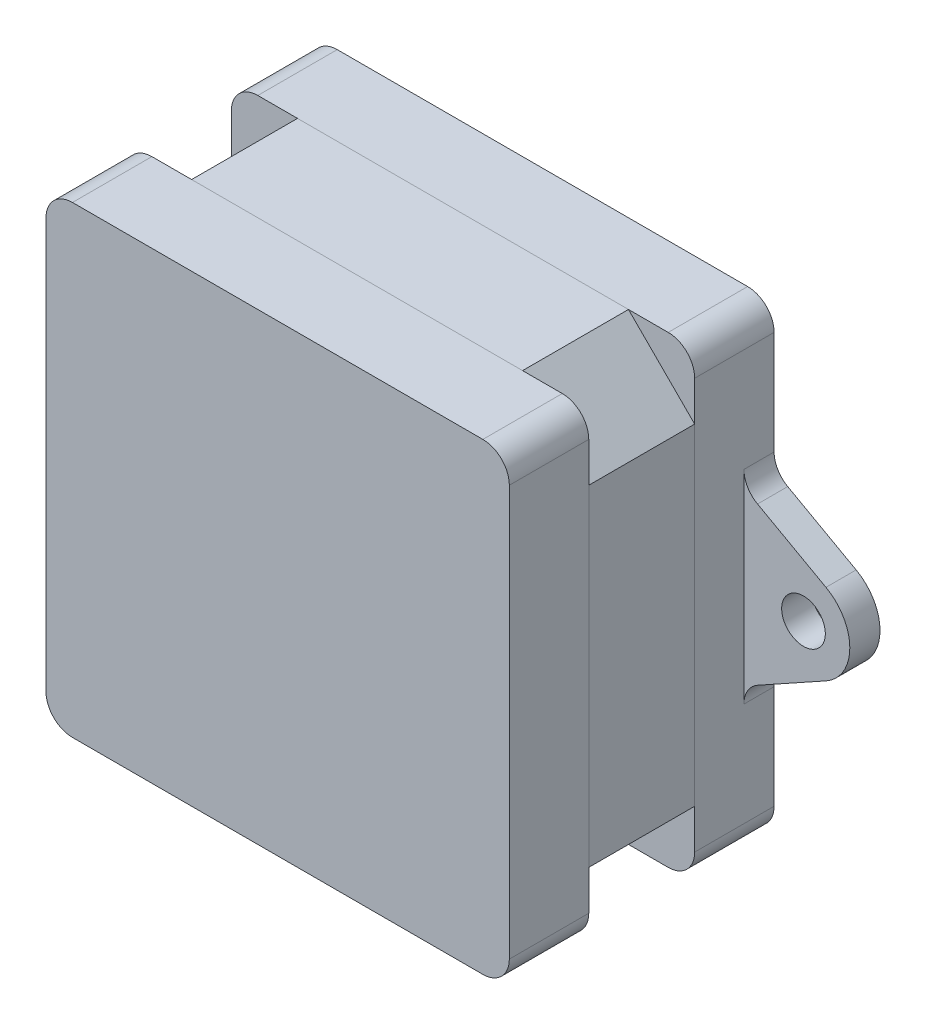
from build123d import *

# Parameters (mm, degrees)
SKETCH1_W                  = 35
SKETCH1_H                  = 35
BOSS_EXTRUDE1_DEPTH        = 6
BOSS_EXTRUDE2_DEPTH        = 8
SKETCH3_W                  = 35
SKETCH3_H                  = 35
BOSS_EXTRUDE3_DEPTH        = 6
M3_TAPPED_HOLE1_AT_2_COUNT = 2
M3_TAPPED_HOLE1_AT_2_PITCH = 26.5
M3_TAPPED_HOLE1_AT_3_COUNT = 2
M3_TAPPED_HOLE1_AT_3_PITCH = 37.476659403
M3_TAPPED_HOLE1_AT_4_COUNT = 2
M3_TAPPED_HOLE1_AT_4_PITCH = 26.5
FILLET1_R                  = 2
FILLET2_R                  = 2
SKETCH6_R                  = 11
SKETCH6_R_2                = 4
BOSS_EXTRUDE4_DEPTH        = 2
FILLET3_R                  = 0.5
SKETCH7_R                  = 2.5
BOSS_EXTRUDE5_DEPTH        = 8.5
SKETCH8_R                  = 2.5
BOSS_EXTRUDE6_DEPTH        = 5.5
SKETCH9_R                  = 1.65
BOSS_EXTRUDE7_DEPTH        = 2.28
FILLET4_R                  = 2


with BuildPart() as part:
    # Sketch1 → Boss-Extrude1 (new body)
    with BuildSketch(Plane.XY):
        with Locations((1.981132075, -1.733490566)):
            Rectangle(SKETCH1_W, SKETCH1_H)
    extrude(amount=BOSS_EXTRUDE1_DEPTH)


with BuildPart() as body_2:
    # Sketch2 → Boss-Extrude2 (new body)
    with BuildSketch(Plane.XY.offset(6)):
        Polygon((-10.518867925, 15.766509434), (-15.518867925, 10.766509434), (-15.518867925, -14.233490566), (-10.518867925, -19.233490566), (14.481132075, -19.233490566), (19.481132075, -14.233490566), (19.481132075, 10.766509434), (14.481132075, 15.766509434), align=None)
    extrude(amount=BOSS_EXTRUDE2_DEPTH)


with BuildPart() as body_3:
    # Sketch3 → Boss-Extrude3 (new body)
    with BuildSketch(Plane.XY.offset(14)):
        with Locations((1.981132075, -1.733490566)):
            Rectangle(SKETCH3_W, SKETCH3_H)
    extrude(amount=BOSS_EXTRUDE3_DEPTH)

    # Fillet2
    fillet2_edges = [body_3.edges().sort_by_distance(p)[0] for p in [
        (19.481132075, 15.766509434, 17),
        (19.481132075, -19.233490566, 17),
        (-15.518867925, -19.233490566, 17),
        (-15.518867925, 15.766509434, 17),
    ]]
    fillet(fillet2_edges, radius=FILLET2_R)


with BuildPart() as m3_tapped_hole1_tool:
    # Sketch4 → M3 Tapped Hole1 (revolve)
    with BuildSketch(Plane(origin=(15.231132075, 11.516509434, 0), x_dir=(0, 1, 0), z_dir=(1, 0, 0))):
        Polygon((0, 0), (0, 8.251075774), (1.25, 7.5), (1.25, 0), align=None)
    m3_tapped_hole1 = revolve(axis=Axis((15.231132075, 11.516509434, -6.35), (0, 0, 1)))


with BuildPart() as part_1:
    add(part.part)

    # M3 Tapped Hole1: cut by m3_tapped_hole1_tool
    add(m3_tapped_hole1_tool.part, mode=Mode.SUBTRACT)


with BuildPart() as body_2_1:
    add(body_2.part)

    # M3 Tapped Hole1: cut by m3_tapped_hole1_tool
    add(m3_tapped_hole1_tool.part, mode=Mode.SUBTRACT)


with BuildPart() as m3_tapped_hole1_at_2_tool:
    # M3 Tapped Hole1 at 2: M3 Tapped Hole1 ×2
    with Locations(*[(-i * M3_TAPPED_HOLE1_AT_2_PITCH, 0, 0) for i in range(1, M3_TAPPED_HOLE1_AT_2_COUNT)]):
        add(m3_tapped_hole1)


with BuildPart() as part_2:
    add(part_1.part)

    # M3 Tapped Hole1 at 2: cut by m3_tapped_hole1_at_2_tool
    add(m3_tapped_hole1_at_2_tool.part, mode=Mode.SUBTRACT)


with BuildPart() as body_2_2:
    add(body_2_1.part)

    # M3 Tapped Hole1 at 2: cut by m3_tapped_hole1_at_2_tool
    add(m3_tapped_hole1_at_2_tool.part, mode=Mode.SUBTRACT)


with BuildPart() as m3_tapped_hole1_at_3_tool:
    # M3 Tapped Hole1 at 3: M3 Tapped Hole1 ×2
    with Locations(*[Vector(-0.7071067811865476, -0.7071067811865476, 0) * (i * M3_TAPPED_HOLE1_AT_3_PITCH) for i in range(1, M3_TAPPED_HOLE1_AT_3_COUNT)]):
        add(m3_tapped_hole1)


with BuildPart() as part_3:
    add(part_2.part)

    # M3 Tapped Hole1 at 3: cut by m3_tapped_hole1_at_3_tool
    add(m3_tapped_hole1_at_3_tool.part, mode=Mode.SUBTRACT)


with BuildPart() as body_2_3:
    add(body_2_2.part)

    # M3 Tapped Hole1 at 3: cut by m3_tapped_hole1_at_3_tool
    add(m3_tapped_hole1_at_3_tool.part, mode=Mode.SUBTRACT)


with BuildPart() as m3_tapped_hole1_at_4_tool:
    # M3 Tapped Hole1 at 4: M3 Tapped Hole1 ×2
    with Locations(*[(0, -i * M3_TAPPED_HOLE1_AT_4_PITCH, 0) for i in range(1, M3_TAPPED_HOLE1_AT_4_COUNT)]):
        add(m3_tapped_hole1)


with BuildPart() as part_4:
    add(part_3.part)

    # M3 Tapped Hole1 at 4: cut by m3_tapped_hole1_at_4_tool
    add(m3_tapped_hole1_at_4_tool.part, mode=Mode.SUBTRACT)

    # Fillet1
    fillet1_edges = [part_4.edges().sort_by_distance(p)[0] for p in [
        (-15.518867925, 15.766509434, 3),
        (19.481132075, 15.766509434, 3),
        (19.481132075, -19.233490566, 3),
        (-15.518867925, -19.233490566, 3),
    ]]
    fillet(fillet1_edges, radius=FILLET1_R)

    # Sketch6 → Boss-Extrude4 (add)
    with BuildSketch(Plane(origin=(0, 0, 0), x_dir=(-1, 0, 0), z_dir=(0, 0, -1))):
        with Locations(Location((-1.981132075, -1.733490566, 0), (0, 0, 180))):
            Circle(SKETCH6_R)
        with Locations((-1.981132075, -1.733490566)):
            Circle(SKETCH6_R_2, mode=Mode.SUBTRACT)
    extrude(amount=BOSS_EXTRUDE4_DEPTH)

    # Fillet3
    fillet3_edges = [part_4.edges().sort_by_distance(p)[0] for p in [
        (-9.018867925, -1.733490566, -2),
    ]]
    fillet(fillet3_edges, radius=FILLET3_R)

    # Sketch9 → Boss-Extrude7 (add)
    # profile 1 of 2: a face of its own
    with BuildSketch(Plane(origin=(0, 0, 0), x_dir=(-1, 0, 0), z_dir=(0, 0, -1))):
        with BuildLine():
            Line((-19.481132075, 4.766509434), (-19.481132075, -8.233490566))
            Line((-19.481132075, -8.233490566), (-25.679427407, -4.793848873))
            ThreePointArc((-25.679427407, -4.793848873), (-27.481132075, -1.733490566), (-25.679427407, 1.326867741))
            Line((-25.679427407, 1.326867741), (-19.481132075, 4.766509434))
        make_face()
        with Locations((-23.981132075, -1.733490566)):
            Circle(SKETCH9_R, mode=Mode.SUBTRACT)
    # profile 2 of 2: a face of its own
    with BuildSketch(Plane(origin=(0, 0, 0), x_dir=(-1, 0, 0), z_dir=(0, 0, -1))):
        with BuildLine():
            Line((15.518867925, -8.233490566), (21.717163256, -4.793848873))
            ThreePointArc((21.717163256, -4.793848873), (23.518867925, -1.733490566), (21.717163256, 1.326867741))
            Line((21.717163256, 1.326867741), (15.518867925, 4.766509434))
            Line((15.518867925, 4.766509434), (15.518867925, -8.233490566))
        make_face()
        with Locations(Location((20.018867925, -1.733490566, 0), (0, 0, 180))):
            Circle(SKETCH9_R, mode=Mode.SUBTRACT)
    extrude(amount=-BOSS_EXTRUDE7_DEPTH)

    # Fillet4
    fillet4_edges = [part_4.edges().sort_by_distance(p)[0] for p in [
        (19.481132075, 4.766509434, 1.14),
        (19.481132075, -8.233490566, 1.14),
        (-15.518867925, -8.233490566, 1.14),
        (-15.518867925, 4.766509434, 1.14),
    ]]
    fillet(fillet4_edges, radius=FILLET4_R)


with BuildPart() as body_2_4:
    add(body_2_3.part)

    # M3 Tapped Hole1 at 4: cut by m3_tapped_hole1_at_4_tool
    add(m3_tapped_hole1_at_4_tool.part, mode=Mode.SUBTRACT)


with BuildPart() as body_4:
    # Sketch7 → Boss-Extrude5 (new body)
    with BuildSketch(Plane(origin=(0, 0, 0), x_dir=(-1, 0, 0), z_dir=(0, 0, -1))):
        with Locations((-1.981132075, -1.733490566)):
            Circle(SKETCH7_R)
    extrude(amount=BOSS_EXTRUDE5_DEPTH)


with BuildPart() as body_5:
    # Sketch8 → Boss-Extrude6 (new body)
    with BuildSketch(Plane(origin=(0, 0, -8.5), x_dir=(-1, 0, 0), z_dir=(0, 0, -1))):
        with BuildLine():
            Line((-1.981132075, 2.166509434), (-1.981132075, 2.841509434))
            ThreePointArc((-1.981132075, 2.841509434), (-1.581132075, 2.823989549), (-1.184195662, 2.771564079))
            Line((-1.184195662, 2.771564079), (-1.301776444, 2.106883885))
            ThreePointArc((-1.301776444, 2.106883885), (-0.784189344, 1.978291768), (-0.288985493, 1.780288019))
            Line((-0.288985493, 1.780288019), (0.003886031, 2.388442005))
            ThreePointArc((0.003886031, 2.388442005), (0.356671985, 2.199103638), (0.691552777, 1.979645666))
            Line((0.691552777, 1.979645666), (0.297222225, 1.431805894))
            ThreePointArc((0.297222225, 1.431805894), (0.70775806, 1.091375774), (1.068010706, 0.698119661))
            Line((1.068010706, 0.698119661), (1.595746957, 1.118975277))
            ThreePointArc((1.595746957, 1.118975277), (1.83144528, 0.795319215), (2.037943203, 0.452295084))
            Line((2.037943203, 0.452295084), (1.444964883, 0.129802119))
            ThreePointArc((1.444964883, 0.129802119), (1.667137796, -0.355039644), (1.821086782, -0.865658924))
            Line((1.821086782, -0.865658924), (2.479163123, -0.715457293))
            ThreePointArc((2.479163123, -0.715457293), (2.551090872, -1.109326999), (2.588306479, -1.507977153))
            Line((2.588306479, -1.507977153), (1.91412702, -1.541249624))
            ThreePointArc((1.91412702, -1.541249624), (1.903932941, -2.074474173), (1.821086782, -2.601322208))
            Line((1.821086782, -2.601322208), (2.479163123, -2.751523839))
            ThreePointArc((2.479163123, -2.751523839), (2.373074124, -3.137596463), (2.233636409, -3.512915087))
            Line((2.233636409, -3.512915087), (1.611785321, -3.250377043))
            ThreePointArc((1.611785321, -3.250377043), (1.371243312, -3.726372716), (1.068010706, -4.165100793))
            Line((1.068010706, -4.165100793), (1.595746957, -4.58595641))
            ThreePointArc((1.595746957, -4.58595641), (1.332653439, -4.887765533), (1.044179749, -5.165416172))
            Line((1.044179749, -5.165416172), (0.597822267, -4.659066492))
            ThreePointArc((0.597822267, -4.659066492), (0.174574623, -4.983556508), (-0.288985493, -5.247269151))
            Line((-0.288985493, -5.247269151), (0.003886031, -5.855423137))
            ThreePointArc((0.003886031, -5.855423137), (-0.364103109, -6.013191762), (-0.74447702, -6.1381823))
            Line((-0.74447702, -6.1381823), (-0.926934323, -5.488309749))
            ThreePointArc((-0.926934323, -5.488309749), (-1.449058215, -5.597024882), (-1.981132075, -5.633490566))
            Line((-1.981132075, -5.633490566), (-1.981132075, -6.308490566))
            ThreePointArc((-1.981132075, -6.308490566), (-2.381132075, -6.290970681), (-2.778068489, -6.238545211))
            Line((-2.778068489, -6.238545211), (-2.660487707, -5.573865017))
            ThreePointArc((-2.660487707, -5.573865017), (-3.178074807, -5.4452729), (-3.673278658, -5.247269151))
            Line((-3.673278658, -5.247269151), (-3.966150182, -5.855423137))
            ThreePointArc((-3.966150182, -5.855423137), (-4.318936136, -5.66608477), (-4.653816928, -5.446626798))
            Line((-4.653816928, -5.446626798), (-4.259486376, -4.898787026))
            ThreePointArc((-4.259486376, -4.898787026), (-4.670022211, -4.558356906), (-5.030274857, -4.165100793))
            Line((-5.030274857, -4.165100793), (-5.558011108, -4.58595641))
            ThreePointArc((-5.558011108, -4.58595641), (-5.793709431, -4.262300347), (-6.000207354, -3.919276216))
            Line((-6.000207354, -3.919276216), (-5.407229034, -3.596783251))
            ThreePointArc((-5.407229034, -3.596783251), (-5.629401947, -3.111941488), (-5.783350933, -2.601322208))
            Line((-5.783350933, -2.601322208), (-6.441427274, -2.751523839))
            ThreePointArc((-6.441427274, -2.751523839), (-6.513355023, -2.357654133), (-6.55057063, -1.959003979))
            Line((-6.55057063, -1.959003979), (-5.876391171, -1.925731508))
            ThreePointArc((-5.876391171, -1.925731508), (-5.866197092, -1.392506959), (-5.783350933, -0.865658924))
            Line((-5.783350933, -0.865658924), (-6.441427274, -0.715457293))
            ThreePointArc((-6.441427274, -0.715457293), (-6.335338275, -0.329384669), (-6.19590056, 0.045933955))
            Line((-6.19590056, 0.045933955), (-5.574049472, -0.216604089))
            ThreePointArc((-5.574049472, -0.216604089), (-5.333507463, 0.259391584), (-5.030274857, 0.698119661))
            Line((-5.030274857, 0.698119661), (-5.558011108, 1.118975277))
            ThreePointArc((-5.558011108, 1.118975277), (-5.294917589, 1.420784401), (-5.0064439, 1.698435039))
            Line((-5.0064439, 1.698435039), (-4.560086418, 1.19208536))
            ThreePointArc((-4.560086418, 1.19208536), (-4.136838774, 1.516575376), (-3.673278658, 1.780288019))
            Line((-3.673278658, 1.780288019), (-3.966150182, 2.388442005))
            ThreePointArc((-3.966150182, 2.388442005), (-3.598161042, 2.546210629), (-3.217787131, 2.671201168))
            Line((-3.217787131, 2.671201168), (-3.035329828, 2.021328617))
            ThreePointArc((-3.035329828, 2.021328617), (-2.513205936, 2.130043749), (-1.981132075, 2.166509434))
        make_face()
        with Locations((-1.981132075, -1.733490566)):
            Circle(SKETCH8_R, mode=Mode.SUBTRACT)
    extrude(amount=-BOSS_EXTRUDE6_DEPTH)


solid = Compound([body_3.part, part_4.part, body_2_4.part, body_4.part, body_5.part])
